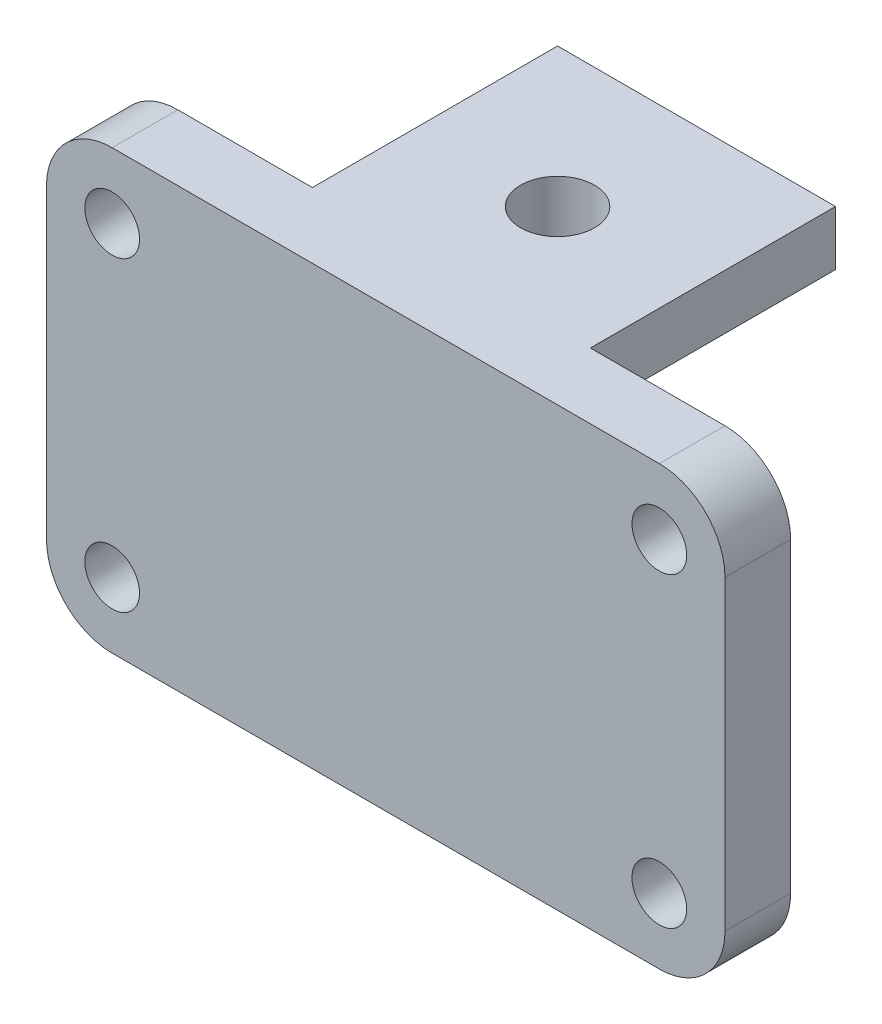
from build123d import *

# Parameters (mm, degrees)
SKETCH1_W               = 25.4
SKETCH1_H               = 25.4
BOSS_EXTRUDE1_DEPTH     = 5
F_1_4_CLEARANCE_HOLE1_D = 6.7564
SKETCH4_R               = 2.5
SKETCH4_W               = 25.4
SKETCH4_H               = 5
BOSS_EXTRUDE2_DEPTH     = 3
FILLET1_R               = 6


with BuildPart() as part:
    # Sketch1 → Boss-Extrude1 (new body)
    with BuildSketch(Plane(origin=(0, 0, 0), x_dir=(1, 0, 0), z_dir=(0, 1, 0))):
        Rectangle(SKETCH1_W, SKETCH1_H)
    extrude(amount=BOSS_EXTRUDE1_DEPTH)

    # 1/4 Clearance Hole1 (through all)
    with Locations(Plane(origin=(0, 5, 0), x_dir=(1, 0, 0), z_dir=(0, 1, 0))):
        with Locations((0, 0)):
            Hole(F_1_4_CLEARANCE_HOLE1_D / 2)

    # Sketch4 → Boss-Extrude2 (add, symmetric)
    # profile 1 of 2: a face of its own
    with BuildSketch(Plane.XY.offset(12.7)):
        Polygon((-31, 5), (-31, -35), (31, -35), (31, 5), (12.7, 5), (12.7, 0), (-12.7, 0), (-12.7, 5), align=None)
        with Locations((-25, -29)):
            Circle(SKETCH4_R, mode=Mode.SUBTRACT)
        with Locations((25, -29)):
            Circle(SKETCH4_R, mode=Mode.SUBTRACT)
        with Locations((-25, -1)):
            Circle(SKETCH4_R, mode=Mode.SUBTRACT)
        with Locations((25, -1)):
            Circle(SKETCH4_R, mode=Mode.SUBTRACT)
    # profile 2 of 2: a face of its own
    with BuildSketch(Plane.XY.offset(12.7)):
        with Locations((0, 2.5)):
            Rectangle(SKETCH4_W, SKETCH4_H)
    extrude(amount=BOSS_EXTRUDE2_DEPTH, both=True)

    # Fillet1
    fillet1_edges = [part.edges().sort_by_distance(p)[0] for p in [
        (-31, 5, 12.7),
        (31, 5, 12.7),
        (31, -35, 12.7),
        (-31, -35, 12.7),
    ]]
    fillet(fillet1_edges, radius=FILLET1_R)


solid = part.part
